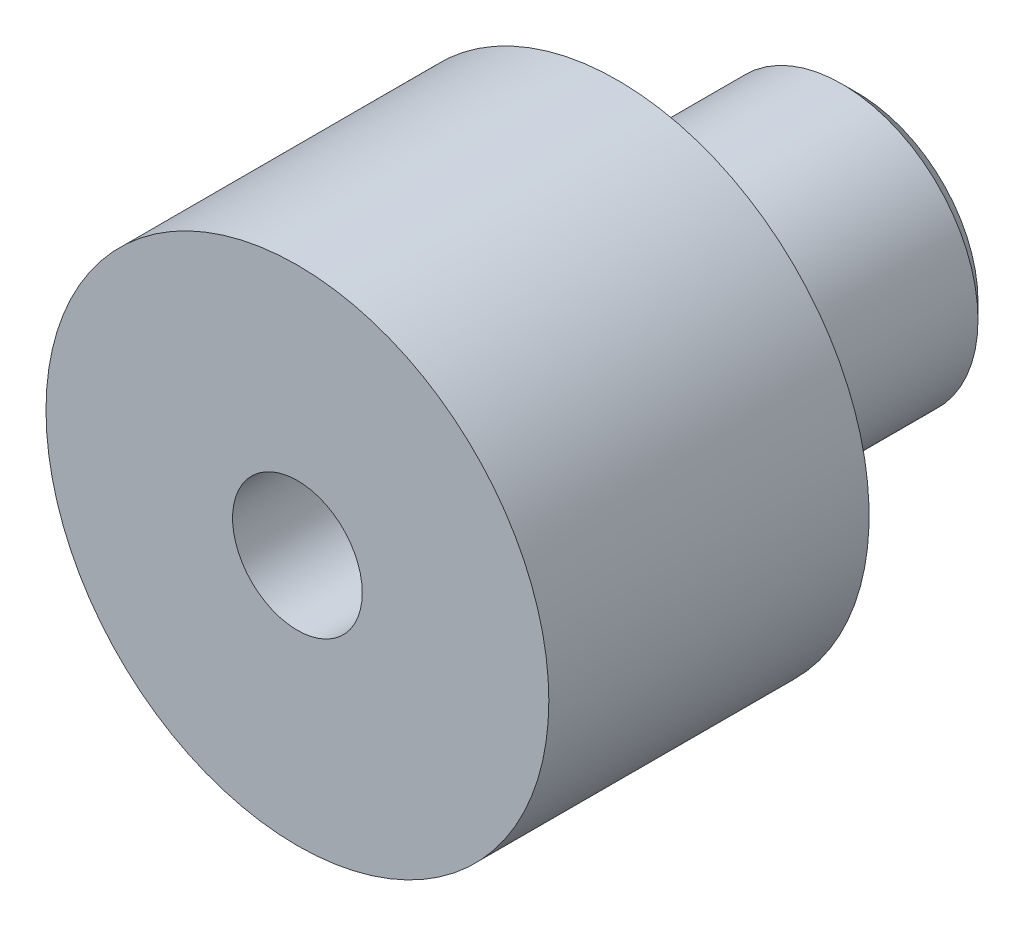
from build123d import *

# Parameters (mm, degrees)
SKETCH1_R           = 8.5
SKETCH1_R_2         = 4.05
BOSS_EXTRUDE1_DEPTH = 30
SKETCH2_R           = 15.7
SKETCH2_R_2         = 10.7
SKETCH2_R_3         = 8.5
SKETCH2_R_4         = 4.05
BOSS_EXTRUDE2_DEPTH = 5
BOSS_EXTRUDE3_START = 15
SKETCH3_R           = 15.7
SKETCH3_R_2         = 10.7
BOSS_EXTRUDE3_DEPTH = 15
FILLET1_R           = 1
CHAMFER1_SIZE       = 1
CHAMFER2_SIZE       = 1


with BuildPart() as part:
    # Sketch1 → Boss-Extrude1 (new body)
    with BuildSketch(Plane.XY):
        Circle(SKETCH1_R)
        Circle(SKETCH1_R_2, mode=Mode.SUBTRACT)
    extrude(amount=BOSS_EXTRUDE1_DEPTH)

    # Sketch2 → Boss-Extrude2 (add)
    # profile 1 of 3: a face of its own
    with BuildSketch(Plane.XY.offset(30)):
        Circle(SKETCH2_R)
        Circle(SKETCH2_R_2, mode=Mode.SUBTRACT)
    # profile 2 of 3: a face of its own
    with BuildSketch(Plane.XY.offset(30)):
        Circle(SKETCH2_R_2)
        Circle(SKETCH2_R_3, mode=Mode.SUBTRACT)
    # profile 3 of 3: a face of its own
    with BuildSketch(Plane.XY.offset(30)):
        Circle(SKETCH2_R_3)
        Circle(SKETCH2_R_4, mode=Mode.SUBTRACT)
    extrude(amount=BOSS_EXTRUDE2_DEPTH)

    # Sketch3 → Boss-Extrude3 (add)
    with BuildSketch(Plane(origin=(0, 0, 30), x_dir=(-1, 0, 0), z_dir=(0, 0, -1)).offset(BOSS_EXTRUDE3_START)):
        Circle(SKETCH3_R)
        Circle(SKETCH3_R_2, mode=Mode.SUBTRACT)
    extrude(amount=-BOSS_EXTRUDE3_DEPTH)

    # Fillet1
    fillet1_edges = [part.edges().sort_by_distance(p)[0] for p in [
        (10.7, 0, 30),
        (-8.5, 0, 30),
    ]]
    fillet(fillet1_edges, radius=FILLET1_R)

    # Chamfer1
    chamfer1_edges = [part.edges().sort_by_distance(p)[0] for p in [
        (10.7, 0, 15),
    ]]
    chamfer(chamfer1_edges, length=CHAMFER1_SIZE)

    # Chamfer2
    chamfer2_edges = [part.edges().sort_by_distance(p)[0] for p in [
        (-8.5, 0, 0),
        (-4.05, 0, 0),
    ]]
    chamfer(chamfer2_edges, length=CHAMFER2_SIZE)


solid = part.part
